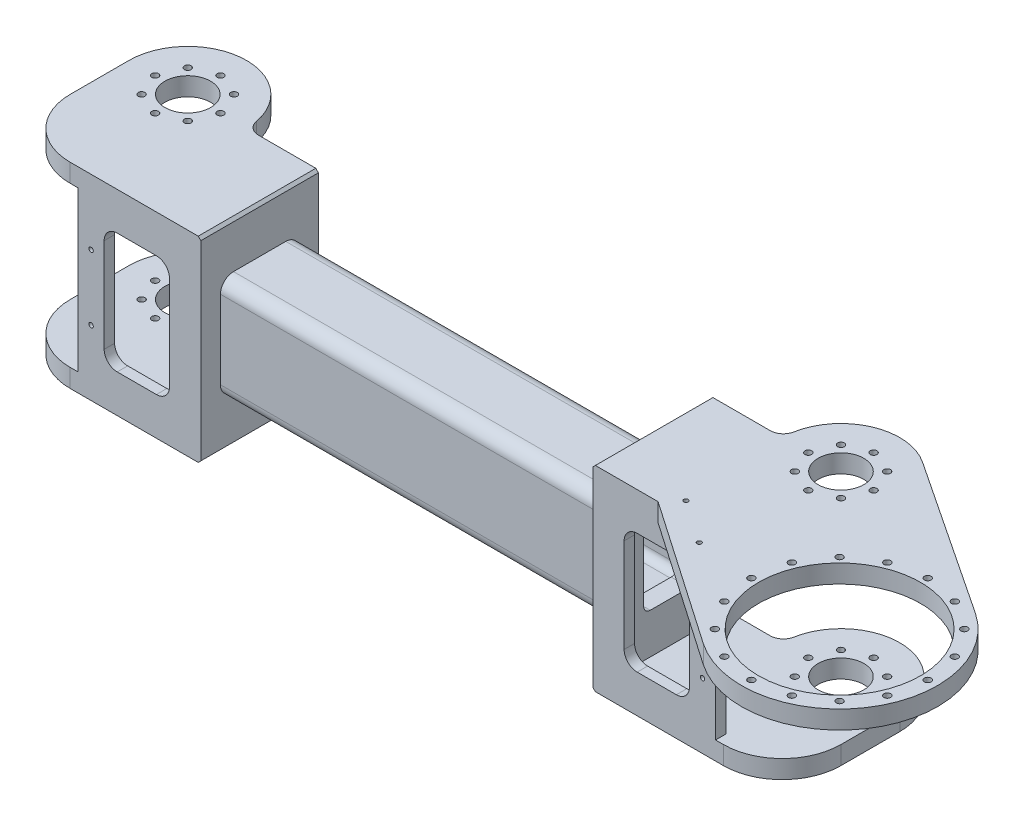
from build123d import *

# Parameters (mm, degrees)
EXTRUDE_1_DEPTH      = 75
SKETCH_2_W           = 300
SKETCH_2_H           = 122
CUT_EXTRUDE_1_DEPTH  = 200
SKETCH_3_R           = 17.5
CUT_EXTRUDE_2_DEPTH  = 240
SKETCH_4_R           = 2.55
CUT_EXTRUDE_3_DEPTH  = 240
EXTRUDE_4_DEPTH      = 75
EXTRUDE_5_DEPTH      = 300
SKETCH_10_W          = 200
SKETCH_10_H          = 122
CUT_EXTRUDE_4_DEPTH  = 200
CUT_EXTRUDE_5_REACH  = 480.147
SKETCH_11_R          = 17.5
CUT_EXTRUDE_6_REACH  = 480.147
SKETCH_12_R          = 2.55
EXTRUDE_6_DEPTH      = 14
SKETCH_14_R          = 62
CUT_EXTRUDE_7_DEPTH  = 14
SKETCH_15_R          = 2.55
CUT_EXTRUDE_8_DEPTH  = 14
CUT_EXTRUDE_9_REACH  = 614.705
SKETCH_17_R          = 1.7
CUT_EXTRUDE_10_DEPTH = 14
SKETCH_18_W          = 8
SKETCH_18_H          = 122
EXTRUDE_7_DEPTH      = 80
CUT_EXTRUDE_11_DEPTH = 8
SKETCH_20_W          = 8
SKETCH_20_H          = 122
EXTRUDE_8_DEPTH      = 80
CUT_EXTRUDE_12_DEPTH = 8
SKETCH_22_R          = 1.7
CUT_EXTRUDE_13_DEPTH = 10
CHAMFER_1_SIZE       = 2
SKETCH_23_R          = 1.7
CUT_EXTRUDE_14_DEPTH = 10


with BuildPart() as part:
    # 草图1 → 凸台-拉伸1 (new, symmetric)
    with BuildSketch(Plane(origin=(0, 0, 0), x_dir=(1, 0, 0), z_dir=(0, 1, 0))):
        with BuildLine():
            Line((-45.916730868, 45), (0, 45))
            Line((0, 45), (0, -45))
            Line((0, -45), (-100, -45))
            ThreePointArc((-100, -45), (-131.819805153, -31.819805153), (-145, 0))
            Line((-145, 0), (-145, 45))
            ThreePointArc((-145, 45), (-104.108063034, 89.812094552), (-55.750052528, 53.181818182))
            ThreePointArc((-55.750052528, 53.181818182), (-52.312752359, 47.312938852), (-45.916730868, 45))
        make_face()
    extrude(amount=EXTRUDE_1_DEPTH, both=True)

    # 草图2 → 切除-拉伸1 (cut)
    with BuildSketch(Plane.XY.offset(45)):
        with Locations((-164, 0)):
            Rectangle(SKETCH_2_W, SKETCH_2_H)
    extrude(amount=-CUT_EXTRUDE_1_DEPTH, mode=Mode.SUBTRACT)

    # 草图3 → 切除-拉伸2 (cut)
    with BuildSketch(Plane(origin=(0, 75, 0), x_dir=(1, 0, 0), z_dir=(0, 1, 0))):
        with Locations(Location((-100, 45, 0), (0, 0, 270))):
            Circle(SKETCH_3_R)
    extrude(amount=-CUT_EXTRUDE_2_DEPTH, mode=Mode.SUBTRACT)

    # 草图4 → 切除-拉伸3 (cut)
    with BuildSketch(Plane.XZ.offset(75)):
        with Locations(Location((-100, -20, 0), (0, 0, 270))):
            Circle(SKETCH_4_R)
        with Locations(Location((-117.67766953, -27.32233047, 0), (0, 0, 270))):
            Circle(SKETCH_4_R)
        with Locations(Location((-125, -45, 0), (0, 0, 270))):
            Circle(SKETCH_4_R)
        with Locations(Location((-117.67766953, -62.67766953, 0), (0, 0, 270))):
            Circle(SKETCH_4_R)
        with Locations(Location((-100, -70, 0), (0, 0, 270))):
            Circle(SKETCH_4_R)
        with Locations(Location((-82.32233047, -62.67766953, 0), (0, 0, 270))):
            Circle(SKETCH_4_R)
        with Locations(Location((-75, -45, 0), (0, 0, 270))):
            Circle(SKETCH_4_R)
        with Locations(Location((-82.32233047, -27.32233047, 0), (0, 0, 270))):
            Circle(SKETCH_4_R)
    extrude(amount=-CUT_EXTRUDE_3_DEPTH, mode=Mode.SUBTRACT)



with BuildPart() as body_2:
    # 草图8 → 凸台-拉伸4 (new, symmetric)
    with BuildSketch(Plane(origin=(0, 0, 0), x_dir=(1, 0, 0), z_dir=(0, 1, 0))):
        with BuildLine():
            Line((345.916730868, 45), (300, 45))
            Line((300, 45), (300, -45))
            Line((300, -45), (400, -45))
            ThreePointArc((400, -45), (431.819805153, -31.819805153), (445, 0))
            Line((445, 0), (445, 45))
            ThreePointArc((445, 45), (404.108063034, 89.812094552), (355.750052528, 53.181818182))
            ThreePointArc((355.750052528, 53.181818182), (352.312752359, 47.312938852), (345.916730868, 45))
        make_face()
    extrude(amount=EXTRUDE_4_DEPTH, both=True)


with BuildPart() as part_1:
    add(part.part)

    add(body_2.part)  # 凸台-拉伸5 merges body 2
    # 草图9 → 凸台-拉伸5 (add)
    with BuildSketch(Plane(origin=(0, 0, 0), x_dir=(0, 0, -1), z_dir=(1, 0, 0))):
        with BuildLine():
            Line((-20, 40), (20, 40))
            ThreePointArc((20, 40), (27.071067812, 37.071067812), (30, 30))
            Line((30, 30), (30, -30))
            ThreePointArc((30, -30), (27.071067812, -37.071067812), (20, -40))
            Line((20, -40), (-20, -40))
            ThreePointArc((-20, -40), (-27.071067812, -37.071067812), (-30, -30))
            Line((-30, -30), (-30, 30))
            ThreePointArc((-30, 30), (-27.071067812, 37.071067812), (-20, 40))
        make_face()
        with BuildLine():
            Line((26, 30), (26, -30))
            ThreePointArc((26, -30), (24.242640687, -34.242640687), (20, -36))
            Line((20, -36), (-20, -36))
            ThreePointArc((-20, -36), (-24.242640687, -34.242640687), (-26, -30))
            Line((-26, -30), (-26, 30))
            ThreePointArc((-26, 30), (-24.242640687, 34.242640687), (-20, 36))
            Line((-20, 36), (20, 36))
            ThreePointArc((20, 36), (24.242640687, 34.242640687), (26, 30))
        make_face(mode=Mode.SUBTRACT)
    extrude(amount=EXTRUDE_5_DEPTH)

    # 草图10 → 切除-拉伸4 (cut)
    with BuildSketch(Plane.XY.offset(45)):
        with Locations((414, 0)):
            Rectangle(SKETCH_10_W, SKETCH_10_H)
    extrude(amount=-CUT_EXTRUDE_4_DEPTH, mode=Mode.SUBTRACT)

    # 切除-拉伸5: up to this face of the body (flat: up to its plane)
    cut_extrude_5_end = Plane(part_1.part.faces().sort_by_distance((376.296187355, -75, -13.901969923))[0])
    # 草图11 → 切除-拉伸5 (cut, up to the picked face)
    with BuildSketch(Plane(origin=(0, 75, 0), x_dir=(1, 0, 0), z_dir=(0, 1, 0)), mode=Mode.PRIVATE) as cut_extrude_5_sk1:
        with Locations(Location((400, 45, 0), (0, 0, 270))):
            Circle(SKETCH_11_R)
    cut_extrude_5_tool1 = split(extrude(cut_extrude_5_sk1.sketch, amount=-CUT_EXTRUDE_5_REACH, mode=Mode.PRIVATE), bisect_by=cut_extrude_5_end, keep=Keep.BOTH, mode=Mode.PRIVATE)
    add(cut_extrude_5_tool1.solids().sort_by(Axis((400, 75, -45), (0, -1, 0)))[0], mode=Mode.SUBTRACT)

    # 切除-拉伸6: up to this face of the body (flat: up to its plane)
    cut_extrude_6_end = Plane(part_1.part.faces().sort_by_distance((374.760455412, -75, -11.887178511))[0])
    # 草图12 → 切除-拉伸6 (cut, up to the picked face)
    with BuildSketch(Plane(origin=(0, 75, 0), x_dir=(1, 0, 0), z_dir=(0, 1, 0)), mode=Mode.PRIVATE) as cut_extrude_6_sk1:
        with Locations(Location((375, 45, 0), (0, 0, 270))):
            Circle(SKETCH_12_R)
    cut_extrude_6_tool1 = split(extrude(cut_extrude_6_sk1.sketch, amount=-CUT_EXTRUDE_6_REACH, mode=Mode.PRIVATE), bisect_by=cut_extrude_6_end, keep=Keep.BOTH, mode=Mode.PRIVATE)
    # 草图12 → 切除-拉伸6 (cut, up to the picked face)
    with BuildSketch(Plane(origin=(0, 75, 0), x_dir=(1, 0, 0), z_dir=(0, 1, 0)), mode=Mode.PRIVATE) as cut_extrude_6_sk2:
        with Locations(Location((382.32233047, 27.32233047, 0), (0, 0, 270))):
            Circle(SKETCH_12_R)
    cut_extrude_6_tool2 = split(extrude(cut_extrude_6_sk2.sketch, amount=-CUT_EXTRUDE_6_REACH, mode=Mode.PRIVATE), bisect_by=cut_extrude_6_end, keep=Keep.BOTH, mode=Mode.PRIVATE)
    # 草图12 → 切除-拉伸6 (cut, up to the picked face)
    with BuildSketch(Plane(origin=(0, 75, 0), x_dir=(1, 0, 0), z_dir=(0, 1, 0)), mode=Mode.PRIVATE) as cut_extrude_6_sk3:
        with Locations(Location((400, 20, 0), (0, 0, 270))):
            Circle(SKETCH_12_R)
    cut_extrude_6_tool3 = split(extrude(cut_extrude_6_sk3.sketch, amount=-CUT_EXTRUDE_6_REACH, mode=Mode.PRIVATE), bisect_by=cut_extrude_6_end, keep=Keep.BOTH, mode=Mode.PRIVATE)
    # 草图12 → 切除-拉伸6 (cut, up to the picked face)
    with BuildSketch(Plane(origin=(0, 75, 0), x_dir=(1, 0, 0), z_dir=(0, 1, 0)), mode=Mode.PRIVATE) as cut_extrude_6_sk4:
        with Locations(Location((417.67766953, 27.32233047, 0), (0, 0, 270))):
            Circle(SKETCH_12_R)
    cut_extrude_6_tool4 = split(extrude(cut_extrude_6_sk4.sketch, amount=-CUT_EXTRUDE_6_REACH, mode=Mode.PRIVATE), bisect_by=cut_extrude_6_end, keep=Keep.BOTH, mode=Mode.PRIVATE)
    # 草图12 → 切除-拉伸6 (cut, up to the picked face)
    with BuildSketch(Plane(origin=(0, 75, 0), x_dir=(1, 0, 0), z_dir=(0, 1, 0)), mode=Mode.PRIVATE) as cut_extrude_6_sk5:
        with Locations(Location((425, 45, 0), (0, 0, 270))):
            Circle(SKETCH_12_R)
    cut_extrude_6_tool5 = split(extrude(cut_extrude_6_sk5.sketch, amount=-CUT_EXTRUDE_6_REACH, mode=Mode.PRIVATE), bisect_by=cut_extrude_6_end, keep=Keep.BOTH, mode=Mode.PRIVATE)
    # 草图12 → 切除-拉伸6 (cut, up to the picked face)
    with BuildSketch(Plane(origin=(0, 75, 0), x_dir=(1, 0, 0), z_dir=(0, 1, 0)), mode=Mode.PRIVATE) as cut_extrude_6_sk6:
        with Locations(Location((417.67766953, 62.67766953, 0), (0, 0, 270))):
            Circle(SKETCH_12_R)
    cut_extrude_6_tool6 = split(extrude(cut_extrude_6_sk6.sketch, amount=-CUT_EXTRUDE_6_REACH, mode=Mode.PRIVATE), bisect_by=cut_extrude_6_end, keep=Keep.BOTH, mode=Mode.PRIVATE)
    # 草图12 → 切除-拉伸6 (cut, up to the picked face)
    with BuildSketch(Plane(origin=(0, 75, 0), x_dir=(1, 0, 0), z_dir=(0, 1, 0)), mode=Mode.PRIVATE) as cut_extrude_6_sk7:
        with Locations(Location((400, 70, 0), (0, 0, 270))):
            Circle(SKETCH_12_R)
    cut_extrude_6_tool7 = split(extrude(cut_extrude_6_sk7.sketch, amount=-CUT_EXTRUDE_6_REACH, mode=Mode.PRIVATE), bisect_by=cut_extrude_6_end, keep=Keep.BOTH, mode=Mode.PRIVATE)
    # 草图12 → 切除-拉伸6 (cut, up to the picked face)
    with BuildSketch(Plane(origin=(0, 75, 0), x_dir=(1, 0, 0), z_dir=(0, 1, 0)), mode=Mode.PRIVATE) as cut_extrude_6_sk8:
        with Locations(Location((382.32233047, 62.67766953, 0), (0, 0, 270))):
            Circle(SKETCH_12_R)
    cut_extrude_6_tool8 = split(extrude(cut_extrude_6_sk8.sketch, amount=-CUT_EXTRUDE_6_REACH, mode=Mode.PRIVATE), bisect_by=cut_extrude_6_end, keep=Keep.BOTH, mode=Mode.PRIVATE)
    add(cut_extrude_6_tool1.solids().sort_by(Axis((375, 75, -45), (0, -1, 0)))[0], mode=Mode.SUBTRACT)
    add(cut_extrude_6_tool2.solids().sort_by(Axis((382.32233, 75, -27.32233), (0, -1, 0)))[0], mode=Mode.SUBTRACT)
    add(cut_extrude_6_tool3.solids().sort_by(Axis((400, 75, -20), (0, -1, 0)))[0], mode=Mode.SUBTRACT)
    add(cut_extrude_6_tool4.solids().sort_by(Axis((417.67767, 75, -27.32233), (0, -1, 0)))[0], mode=Mode.SUBTRACT)
    add(cut_extrude_6_tool5.solids().sort_by(Axis((425, 75, -45), (0, -1, 0)))[0], mode=Mode.SUBTRACT)
    add(cut_extrude_6_tool6.solids().sort_by(Axis((417.67767, 75, -62.67767), (0, -1, 0)))[0], mode=Mode.SUBTRACT)
    add(cut_extrude_6_tool7.solids().sort_by(Axis((400, 75, -70), (0, -1, 0)))[0], mode=Mode.SUBTRACT)
    add(cut_extrude_6_tool8.solids().sort_by(Axis((382.32233, 75, -62.67767), (0, -1, 0)))[0], mode=Mode.SUBTRACT)

    # 草图13 → 凸台-拉伸6 (add)
    with BuildSketch(Plane(origin=(0, 75, 0), x_dir=(1, 0, 0), z_dir=(0, 1, 0))):
        with BuildLine():
            Line((400, -45), (350, -45))
            Line((350, -45), (461.360881331, -121.753234164))
            ThreePointArc((461.360881331, -121.753234164), (566.044222181, -102.023324176), (545.404349124, 2.484411614))
            Line((545.404349124, 2.484411614), (424.888780402, 82.490646968))
            ThreePointArc((424.888780402, 82.490646968), (439.65472934, 66.272104761), (445, 45))
            Line((445, 45), (445, 0))
            ThreePointArc((445, 0), (431.819805153, -31.819805153), (400, -45))
        make_face()
    extrude(amount=-EXTRUDE_6_DEPTH)

    # 草图14 → 切除-拉伸7 (cut)
    with BuildSketch(Plane(origin=(0, 75, 0), x_dir=(1, 0, 0), z_dir=(0, 1, 0))):
        with Locations(Location((503.923048454, -60, 0), (0, 0, 270))):
            Circle(SKETCH_14_R)
    extrude(amount=-CUT_EXTRUDE_7_DEPTH, mode=Mode.SUBTRACT)

    # 草图15 → 切除-拉伸8 (cut)
    with BuildSketch(Plane(origin=(0, 75, 0), x_dir=(1, 0, 0), z_dir=(0, 1, 0))):
        with Locations(Location((503.923048454, -127.5, 0), (0, 0, 270))):
            Circle(SKETCH_15_R)
        with Locations(Location((529.754180139, -122.361868445, 0), (0, 0, 270))):
            Circle(SKETCH_15_R)
        with Locations(Location((551.652756184, -107.72970773, 0), (0, 0, 270))):
            Circle(SKETCH_15_R)
        with Locations(Location((566.284916899, -85.831131685, 0), (0, 0, 270))):
            Circle(SKETCH_15_R)
        with Locations(Location((571.423048454, -60, 0), (0, 0, 270))):
            Circle(SKETCH_15_R)
        with Locations(Location((566.284916899, -34.168868315, 0), (0, 0, 270))):
            Circle(SKETCH_15_R)
        with Locations(Location((551.652756184, -12.27029227, 0), (0, 0, 270))):
            Circle(SKETCH_15_R)
        with Locations(Location((529.754180139, 2.361868445, 0), (0, 0, 270))):
            Circle(SKETCH_15_R)
        with Locations(Location((503.923048454, 7.5, 0), (0, 0, 270))):
            Circle(SKETCH_15_R)
        with Locations(Location((478.091916769, 2.361868445, 0), (0, 0, 270))):
            Circle(SKETCH_15_R)
        with Locations(Location((456.193340724, -12.27029227, 0), (0, 0, 270))):
            Circle(SKETCH_15_R)
        with Locations(Location((441.56118001, -34.168868315, 0), (0, 0, 270))):
            Circle(SKETCH_15_R)
        with Locations(Location((436.423048454, -60, 0), (0, 0, 270))):
            Circle(SKETCH_15_R)
        with Locations(Location((441.56118001, -85.831131685, 0), (0, 0, 270))):
            Circle(SKETCH_15_R)
        with Locations(Location((456.193340724, -107.72970773, 0), (0, 0, 270))):
            Circle(SKETCH_15_R)
        with Locations(Location((478.091916769, -122.361868445, 0), (0, 0, 270))):
            Circle(SKETCH_15_R)
    extrude(amount=-CUT_EXTRUDE_8_DEPTH, mode=Mode.SUBTRACT)

    # 切除-拉伸9: up to this face of the body (flat: up to its plane)
    cut_extrude_9_end = Plane(part_1.part.faces().sort_by_distance((314, 0, 0))[0])
    # 草图16 → 切除-拉伸9 (cut, up to the picked face)
    with BuildSketch(Plane.ZY.offset(14), mode=Mode.PRIVATE) as cut_extrude_9_sk1:
        with BuildLine():
            Line((-15, 30), (15, 30))
            ThreePointArc((15, 30), (18.535533906, 28.535533906), (20, 25))
            Line((20, 25), (20, -25))
            ThreePointArc((20, -25), (18.535533906, -28.535533906), (15, -30))
            Line((15, -30), (-15, -30))
            ThreePointArc((-15, -30), (-18.535533906, -28.535533906), (-20, -25))
            Line((-20, -25), (-20, 25))
            ThreePointArc((-20, 25), (-18.535533906, 28.535533906), (-15, 30))
        make_face()
    cut_extrude_9_tool1 = split(extrude(cut_extrude_9_sk1.sketch, amount=-CUT_EXTRUDE_9_REACH, mode=Mode.PRIVATE), bisect_by=cut_extrude_9_end, keep=Keep.BOTH, mode=Mode.PRIVATE)
    add(cut_extrude_9_tool1.solids().sort_by(Axis((-14, 0, 0), (1, 0, 0)))[0], mode=Mode.SUBTRACT)

    # 草图17 → 切除-拉伸10 (cut)
    with BuildSketch(Plane(origin=(0, 75, 0), x_dir=(1, 0, 0), z_dir=(0, 1, 0))):
        with Locations(Location((360, -33.67462833, 0), (0, 0, 270))):
            Circle(SKETCH_17_R)
        with Locations(Location((392.935058221, -56.374450795, 0), (0, 0, 270))):
            Circle(SKETCH_17_R)
    extrude(amount=-CUT_EXTRUDE_10_DEPTH, mode=Mode.SUBTRACT)

    # 草图18 → 凸台-拉伸7 (add)
    with BuildSketch(Plane(origin=(314, 0, 0), x_dir=(0, 0, -1), z_dir=(1, 0, 0))):
        with Locations((-41, 0)):
            Rectangle(SKETCH_18_W, SKETCH_18_H)
    extrude(amount=EXTRUDE_7_DEPTH)

    # 草图19 → 切除-拉伸11 (cut)
    with BuildSketch(Plane(origin=(0, 0, 37), x_dir=(-1, 0, 0), z_dir=(0, 0, -1))):
        with BuildLine():
            Line((-364, 46), (-334, 46))
            ThreePointArc((-334, 46), (-326.928932188, 43.071067812), (-324, 36))
            Line((-324, 36), (-324, -36))
            ThreePointArc((-324, -36), (-326.928932188, -43.071067812), (-334, -46))
            Line((-334, -46), (-364, -46))
            ThreePointArc((-364, -46), (-371.071067812, -43.071067812), (-374, -36))
            Line((-374, -36), (-374, 36))
            ThreePointArc((-374, 36), (-371.071067812, 43.071067812), (-364, 46))
        make_face()
    extrude(amount=-CUT_EXTRUDE_11_DEPTH, mode=Mode.SUBTRACT)

    # 草图20 → 凸台-拉伸8 (add)
    with BuildSketch(Plane.ZY.offset(14)):
        with Locations((41, 0)):
            Rectangle(SKETCH_20_W, SKETCH_20_H)
    extrude(amount=EXTRUDE_8_DEPTH)

    # 草图21 → 切除-拉伸12 (cut)
    with BuildSketch(Plane(origin=(0, 0, 37), x_dir=(-1, 0, 0), z_dir=(0, 0, -1))):
        with BuildLine():
            Line((34, 46), (64, 46))
            ThreePointArc((64, 46), (71.071067812, 43.071067812), (74, 36))
            Line((74, 36), (74, -36))
            ThreePointArc((74, -36), (71.071067812, -43.071067812), (64, -46))
            Line((64, -46), (34, -46))
            ThreePointArc((34, -46), (26.928932188, -43.071067812), (24, -36))
            Line((24, -36), (24, 36))
            ThreePointArc((24, 36), (26.928932188, 43.071067812), (34, 46))
        make_face()
    extrude(amount=-CUT_EXTRUDE_12_DEPTH, mode=Mode.SUBTRACT)

    # 草图22 → 切除-拉伸13 (cut)
    with BuildSketch(Plane(origin=(0, 0, 37), x_dir=(-1, 0, 0), z_dir=(0, 0, -1))):
        with Locations(Location((84, 25, 0), (0, 0, 90))):
            Circle(SKETCH_22_R)
        with Locations(Location((84, -25, 0), (0, 0, 90))):
            Circle(SKETCH_22_R)
    extrude(amount=-CUT_EXTRUDE_13_DEPTH, mode=Mode.SUBTRACT)

    # 倒角1
    chamfer_1_edges = [part_1.edges().sort_by_distance(p)[0] for p in [
        (300, -75, 0),
        (300, 75, 0),
        (0, 75, 0),
        (0, -75, 0),
    ]]
    chamfer(chamfer_1_edges, length=CHAMFER_1_SIZE)

    # 草图23 → 切除-拉伸14 (cut)
    with BuildSketch(Plane(origin=(0, 0, 37), x_dir=(-1, 0, 0), z_dir=(0, 0, -1))):
        with Locations(Location((-384, 25, 0), (0, 0, 90))):
            Circle(SKETCH_23_R)
        with Locations(Location((-384, -25, 0), (0, 0, 90))):
            Circle(SKETCH_23_R)
    extrude(amount=-CUT_EXTRUDE_14_DEPTH, mode=Mode.SUBTRACT)


solid = part_1.part
